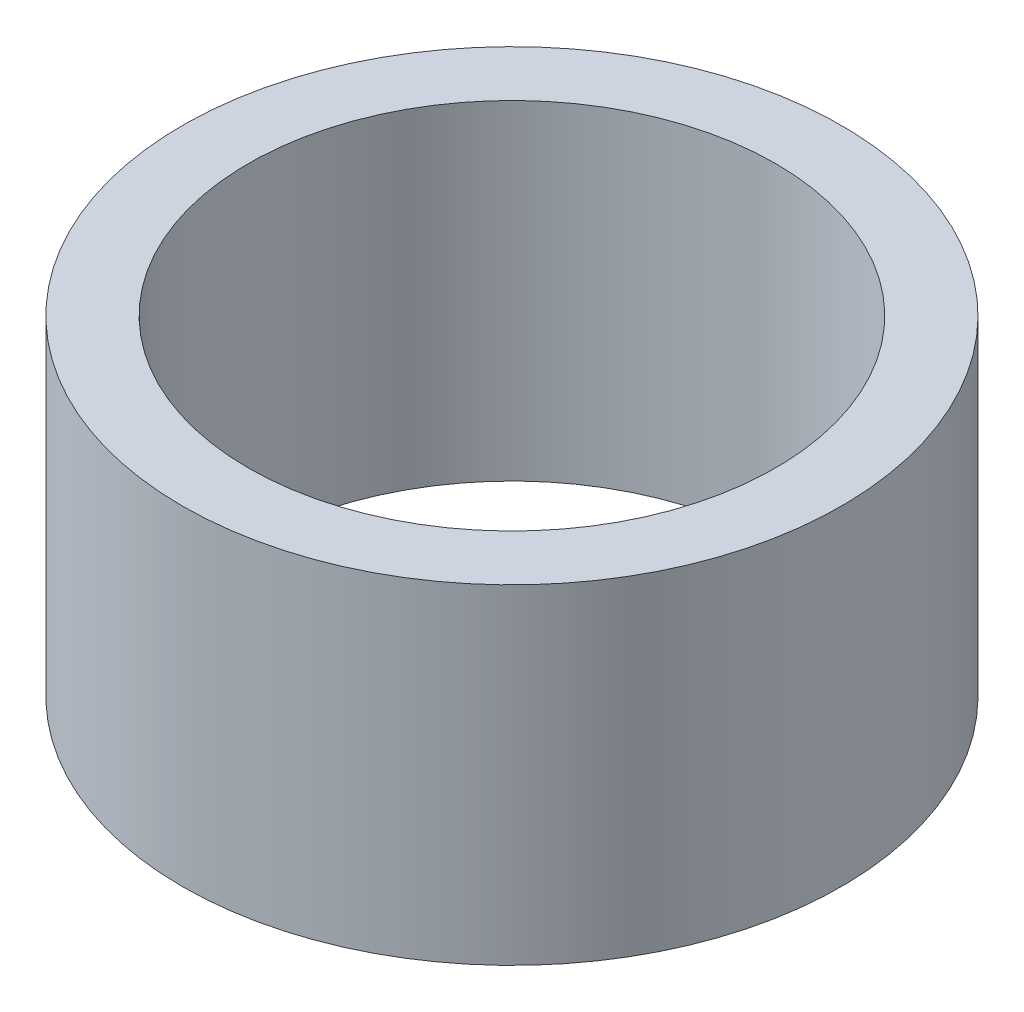
from build123d import *

# Parameters (mm, degrees)
SKETCH2_R           = 5
SKETCH2_R_2         = 4
BOSS_EXTRUDE1_DEPTH = 5


with BuildPart() as part:
    # Sketch2 → Boss-Extrude1 (new body)
    with BuildSketch(Plane(origin=(0, 0, 0), x_dir=(1, 0, 0), z_dir=(0, 1, 0))):
        with Locations(Location((0, 0, 0), (0, 0, 270))):
            Circle(SKETCH2_R)
        with Locations(Location((0, 0, 0), (0, 0, 270))):
            Circle(SKETCH2_R_2, mode=Mode.SUBTRACT)
    extrude(amount=BOSS_EXTRUDE1_DEPTH)


solid = part.part
